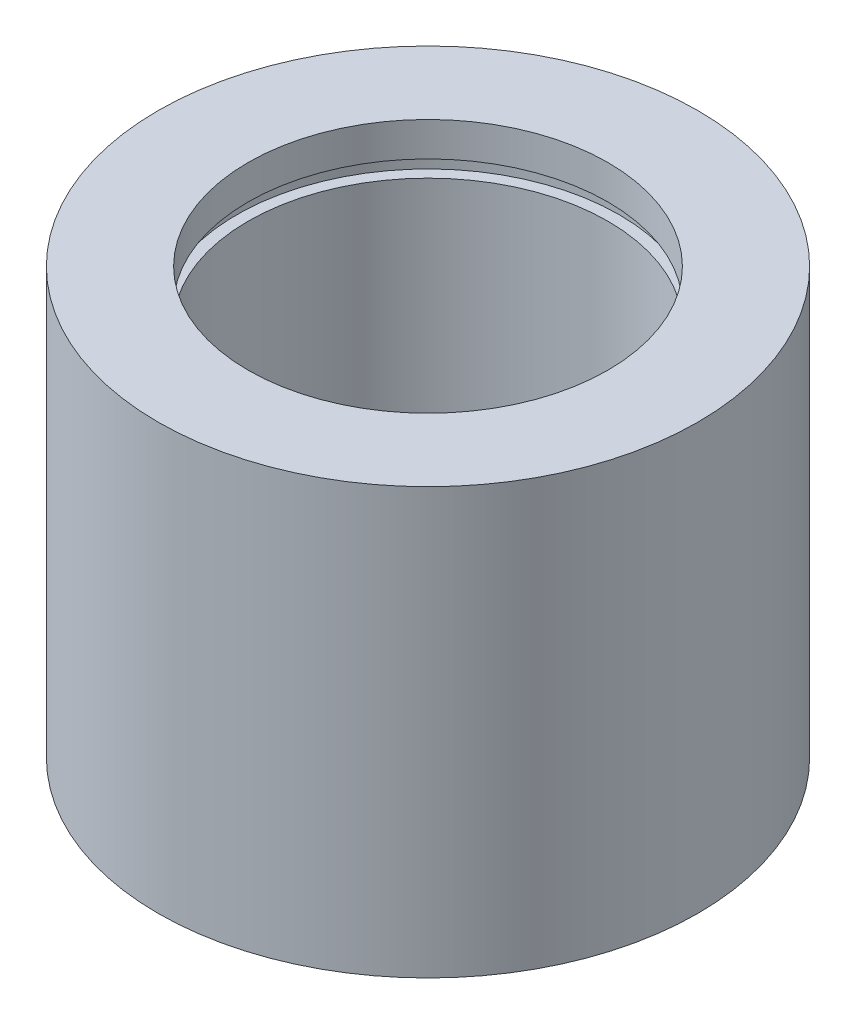
from build123d import *


with BuildPart() as part:
    # Sketch1 → Revolve1 (revolve)
    with BuildSketch(Plane.XY, mode=Mode.PRIVATE) as revolve1_sk:
        Polygon((20, 0), (30, 0), (30, 47.3), (20, 47.3), (20, 43.5), (21.25, 43.5), (21.25, 41.65), (20, 41.65), (20, 5.65), (21.25, 5.65), (21.25, 3.8), (20, 3.8), align=None)
    revolve(revolve1_sk.sketch.rotate(Axis((0, 0, 0), (0, 1, 0)), 90), axis=Axis((0, 0, 0), (0, 1, 0)))


solid = part.part
